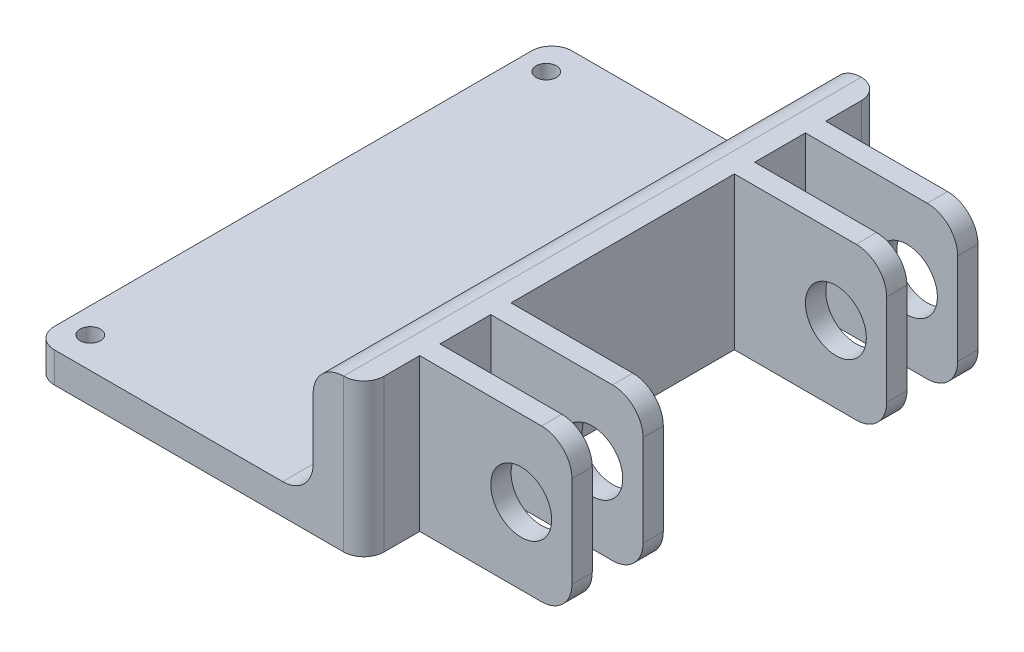
from build123d import *

# Parameters (mm, degrees)
BOSS_EXTRUDE1_DEPTH = 15
SKETCH2_R           = 3
CUT_EXTRUDE1_DEPTH  = 51
FILLET1_R           = 3
FILLET2_R           = 3
FILLET3_R           = 3
FILLET4_R           = 3
FILLET5_R           = 3
FILLET6_R           = 3
SKETCH4_W           = 40
SKETCH4_H           = 51
CUT_EXTRUDE2_DEPTH  = 12
SKETCH5_R           = 1
CUT_EXTRUDE3_DEPTH  = 12
FILLET7_R           = 3
FILLET8_R           = 3
SKETCH7_W           = 15
SKETCH7_H           = 22
CUT_EXTRUDE5_DEPTH  = 20
SKETCH9_W           = 15
SKETCH9_H           = 5.5
CUT_EXTRUDE6_DEPTH  = 20
FILLET11_R          = 2
FILLET12_R          = 2
SKETCH11_W          = 12.51
SKETCH11_H          = 51
CUT_EXTRUDE7_DEPTH  = 3
FILLET13_R          = 2
FILLET14_R          = 2


with BuildPart() as part:
    # Sketch1 → Boss-Extrude1 (new body)
    with BuildSketch(Plane(origin=(0, 0, 0), x_dir=(1, 0, 0), z_dir=(0, 1, 0))):
        Polygon((-30, 25.5), (30, 25.5), (30, 18), (15, 18), (15, 13), (30, 13), (30, -13), (15, -13), (15, -18), (30, -18), (30, -25.5), (-30, -25.5), align=None)
    extrude(amount=BOSS_EXTRUDE1_DEPTH)

    # Sketch2 → Cut-Extrude1 (cut)
    with BuildSketch(Plane.XY.offset(25.5)):
        with Locations((25, 7.5)):
            Circle(SKETCH2_R)
    extrude(amount=-CUT_EXTRUDE1_DEPTH, mode=Mode.SUBTRACT)

    # Fillet1
    fillet1_edges = [part.edges().sort_by_distance(p)[0] for p in [
        (30, 15, 21.75),
    ]]
    fillet(fillet1_edges, radius=FILLET1_R)

    # Fillet2
    fillet2_edges = [part.edges().sort_by_distance(p)[0] for p in [
        (30, 15, 0),
    ]]
    fillet(fillet2_edges, radius=FILLET2_R)

    # Fillet3
    fillet3_edges = [part.edges().sort_by_distance(p)[0] for p in [
        (30, 15, -21.75),
    ]]
    fillet(fillet3_edges, radius=FILLET3_R)

    # Fillet4
    fillet4_edges = [part.edges().sort_by_distance(p)[0] for p in [
        (30, 0, 21.75),
    ]]
    fillet(fillet4_edges, radius=FILLET4_R)

    # Fillet5
    fillet5_edges = [part.edges().sort_by_distance(p)[0] for p in [
        (30, 0, 0),
    ]]
    fillet(fillet5_edges, radius=FILLET5_R)

    # Fillet6
    fillet6_edges = [part.edges().sort_by_distance(p)[0] for p in [
        (30, 0, -21.75),
    ]]
    fillet(fillet6_edges, radius=FILLET6_R)

    # Sketch4 → Cut-Extrude2 (cut)
    with BuildSketch(Plane(origin=(0, 15, 0), x_dir=(1, 0, 0), z_dir=(0, 1, 0))):
        with Locations((-10, 0)):
            Rectangle(SKETCH4_W, SKETCH4_H)
    extrude(amount=-CUT_EXTRUDE2_DEPTH, mode=Mode.SUBTRACT)

    # Sketch5 → Cut-Extrude3 (cut)
    with BuildSketch(Plane(origin=(0, 3, 0), x_dir=(1, 0, 0), z_dir=(0, 1, 0))):
        with Locations(Location((-14.99, 22.46, 0), (0, 0, 270))):
            Circle(SKETCH5_R)
        with Locations(Location((-14.99, -22.46, 0), (0, 0, 270))):
            Circle(SKETCH5_R)
    extrude(amount=-CUT_EXTRUDE3_DEPTH, mode=Mode.SUBTRACT)

    # Fillet7
    fillet7_edges = [part.edges().sort_by_distance(p)[0] for p in [
        (10, 15, 0),
    ]]
    fillet(fillet7_edges, radius=FILLET7_R)

    # Fillet8
    fillet8_edges = [part.edges().sort_by_distance(p)[0] for p in [
        (10, 3, 0),
    ]]
    fillet(fillet8_edges, radius=FILLET8_R)

    # Sketch7 → Cut-Extrude5 (cut)
    with BuildSketch(Plane(origin=(0, 15, 0), x_dir=(1, 0, 0), z_dir=(0, 1, 0))):
        with Locations((22.5, 0)):
            Rectangle(SKETCH7_W, SKETCH7_H)
    extrude(amount=-CUT_EXTRUDE5_DEPTH, mode=Mode.SUBTRACT)

    # Sketch9 → Cut-Extrude6 (cut)
    with BuildSketch(Plane(origin=(0, 15, 0), x_dir=(1, 0, 0), z_dir=(0, 1, 0))):
        with Locations((22.5, 22.75)):
            Rectangle(SKETCH9_W, SKETCH9_H)
        with Locations((22.5, -22.75)):
            Rectangle(SKETCH9_W, SKETCH9_H)
    extrude(amount=-CUT_EXTRUDE6_DEPTH, mode=Mode.SUBTRACT)

    # Fillet11
    fillet11_edges = [part.edges().sort_by_distance(p)[0] for p in [
        (15, 7.5, 25.5),
    ]]
    fillet(fillet11_edges, radius=FILLET11_R)

    # Fillet12
    fillet12_edges = [part.edges().sort_by_distance(p)[0] for p in [
        (15, 7.5, -25.5),
    ]]
    fillet(fillet12_edges, radius=FILLET12_R)

    # Sketch11 → Cut-Extrude7 (cut)
    with BuildSketch(Plane(origin=(0, 3, 0), x_dir=(1, 0, 0), z_dir=(0, 1, 0))):
        with Locations((-23.745, 0)):
            Rectangle(SKETCH11_W, SKETCH11_H)
    extrude(amount=-CUT_EXTRUDE7_DEPTH, mode=Mode.SUBTRACT)

    # Fillet13
    fillet13_edges = [part.edges().sort_by_distance(p)[0] for p in [
        (-17.49, 1.5, 25.5),
    ]]
    fillet(fillet13_edges, radius=FILLET13_R)

    # Fillet14
    fillet14_edges = [part.edges().sort_by_distance(p)[0] for p in [
        (-17.49, 1.5, -25.5),
    ]]
    fillet(fillet14_edges, radius=FILLET14_R)


solid = part.part
